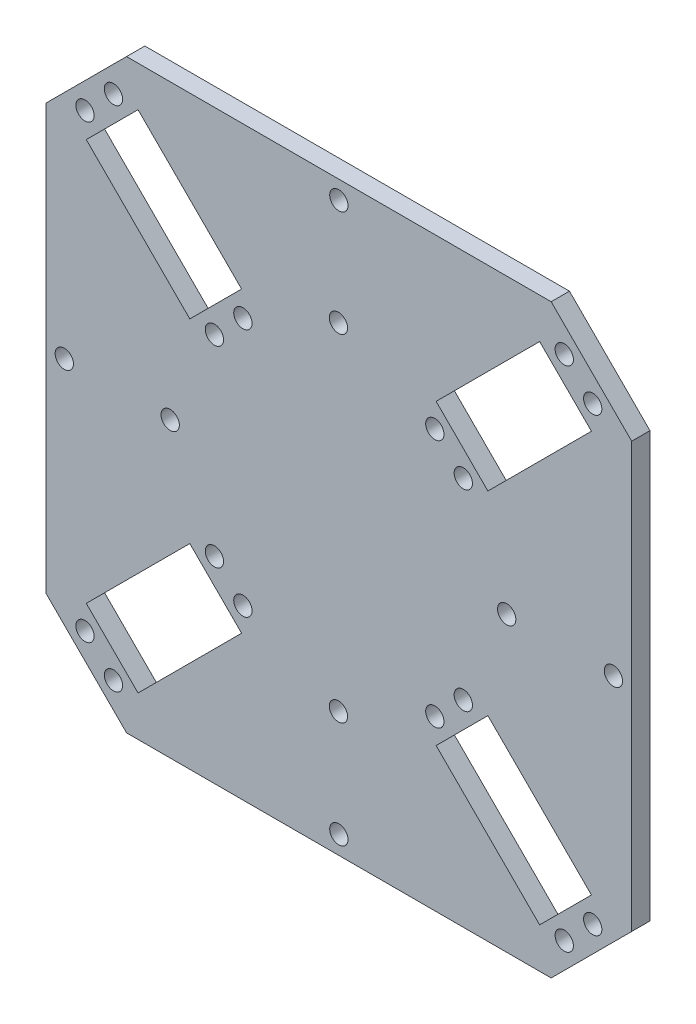
from build123d import *

# Parameters (mm, degrees)
ESQUISSE1_W               = 160
ESQUISSE1_H               = 160
BOSS_EXTRU_1_DEPTH        = 5
CHANFREIN3_SIZE           = 22
CHANFREIN4_SIZE           = 22
ENL_V_MAT_EXTRU_1_DEPTH   = 5
SYM_TRIE2_COPY_1_DEPTH    = 5
ESQUISSE8_R               = 2.5
ENL_V_MAT_EXTRU_2_DEPTH   = 5
SYM_TRIE4_COPY_1_SKETCH_R = 2.5
SYM_TRIE4_COPY_1_DEPTH    = 5
ESQUISSE9_R               = 2.5
ENL_V_MAT_EXTRU_3_DEPTH   = 5
SYM_TRIE6_COPY_1_SKETCH_R = 2.5
SYM_TRIE6_COPY_1_DEPTH    = 5
ESQUISSE10_R              = 2.5
ENL_V_MAT_EXTRU_4_DEPTH   = 10
ESQUISSE12_R              = 2.5
ENL_V_MAT_EXTRU_5_DEPTH   = 10


with BuildPart() as part:
    # Esquisse1 → Boss.-Extru.1 (new body)
    with BuildSketch(Plane.XY):
        with Locations((80, -80)):
            Rectangle(ESQUISSE1_W, ESQUISSE1_H)
    extrude(amount=BOSS_EXTRU_1_DEPTH)

    # Chanfrein3
    chanfrein3_edges = [part.edges().sort_by_distance(p)[0] for p in [
        (0, 0, 2.5),
    ]]
    chamfer(chanfrein3_edges, length=CHANFREIN3_SIZE)

    # Chanfrein4
    chanfrein4_edges = [part.edges().sort_by_distance(p)[0] for p in [
        (160, 0, 2.5),
        (160, -160, 2.5),
        (0, -160, 2.5),
    ]]
    chamfer(chanfrein4_edges, length=CHANFREIN4_SIZE)

    # Esquisse3 → Enlèv. mat.-Extru.1 (cut)
    with BuildSketch(Plane.XY.offset(5)):
        Polygon((25.143089642, -10.999045981), (11.000954019, -25.141181605), (39.285225266, -53.425452853), (53.42736089, -39.283317229), align=None)
    enl_v_mat_extru_1 = extrude(amount=-ENL_V_MAT_EXTRU_1_DEPTH, mode=Mode.SUBTRACT)

    # Symétrie1: Enlèv. mat.-Extru.1 across plane
    add(enl_v_mat_extru_1.mirror(Plane.ZX.offset(-80)), mode=Mode.SUBTRACT)

    # Symétrie2: Enlèv. mat.-Extru.1 across plane
    add(enl_v_mat_extru_1.mirror(Plane(origin=(80, 0, 0), x_dir=(0, 0, 1), z_dir=(1, 0, 0))), mode=Mode.SUBTRACT)

    # Symétrie2 copy 1 sketch → Symétrie2 copy 1 (cut)
    with BuildSketch(Plane(origin=(160, -160, 5), x_dir=(-1, 0, 0), z_dir=(0, 0, 1))):
        Polygon((25.143089642, -10.999045981), (11.000954019, -25.141181605), (39.285225266, -53.425452853), (53.42736089, -39.283317229), align=None)
    extrude(amount=-SYM_TRIE2_COPY_1_DEPTH, mode=Mode.SUBTRACT)

    # Esquisse8 → Enlèv. mat.-Extru.2 (cut)
    with BuildSketch(Plane.XY.offset(5)):
        with Locations((10.647400628, -18.423667184)):
            Circle(ESQUISSE8_R)
        with Locations((18.425575221, -10.645492591)):
            Circle(ESQUISSE8_R)
    enl_v_mat_extru_2 = extrude(amount=-ENL_V_MAT_EXTRU_2_DEPTH, mode=Mode.SUBTRACT)

    # Symétrie3: Enlèv. mat.-Extru.2 across plane
    add(enl_v_mat_extru_2.mirror(Plane.ZX.offset(-80)), mode=Mode.SUBTRACT)

    # Symétrie4: Enlèv. mat.-Extru.2 across plane
    add(enl_v_mat_extru_2.mirror(Plane(origin=(80, 0, 0), x_dir=(0, 0, 1), z_dir=(1, 0, 0))), mode=Mode.SUBTRACT)

    # Symétrie4 copy 1 sketch → Symétrie4 copy 1 (cut)
    with BuildSketch(Plane(origin=(160, -160, 5), x_dir=(-1, 0, 0), z_dir=(0, 0, 1))):
        with Locations((10.647400628, -18.423667184)):
            Circle(SYM_TRIE4_COPY_1_SKETCH_R)
        with Locations((18.425575221, -10.645492591)):
            Circle(SYM_TRIE4_COPY_1_SKETCH_R)
    extrude(amount=-SYM_TRIE4_COPY_1_DEPTH, mode=Mode.SUBTRACT)

    # Esquisse9 → Enlèv. mat.-Extru.3 (cut)
    with BuildSketch(Plane.XY.offset(5)):
        with Locations((53.78091428, -46.00083165)):
            Circle(ESQUISSE9_R)
        with Locations((46.002739687, -53.779006243)):
            Circle(ESQUISSE9_R)
    enl_v_mat_extru_3 = extrude(amount=-ENL_V_MAT_EXTRU_3_DEPTH, mode=Mode.SUBTRACT)

    # Symétrie5: Enlèv. mat.-Extru.3 across plane
    add(enl_v_mat_extru_3.mirror(Plane.ZX.offset(-80)), mode=Mode.SUBTRACT)

    # Symétrie6: Enlèv. mat.-Extru.3 across plane
    add(enl_v_mat_extru_3.mirror(Plane(origin=(80, 0, 0), x_dir=(0, 0, 1), z_dir=(1, 0, 0))), mode=Mode.SUBTRACT)

    # Symétrie6 copy 1 sketch → Symétrie6 copy 1 (cut)
    with BuildSketch(Plane(origin=(160, -160, 5), x_dir=(-1, 0, 0), z_dir=(0, 0, 1))):
        with Locations((53.78091428, -46.00083165)):
            Circle(SYM_TRIE6_COPY_1_SKETCH_R)
        with Locations((46.002739687, -53.779006243)):
            Circle(SYM_TRIE6_COPY_1_SKETCH_R)
    extrude(amount=-SYM_TRIE6_COPY_1_DEPTH, mode=Mode.SUBTRACT)

    # Esquisse10 → Enlèv. mat.-Extru.4 (cut)
    with BuildSketch(Plane.XY.offset(5)):
        with Locations((79.885822331, -34.038059223)):
            Circle(ESQUISSE10_R)
        with Locations((33.923881554, -80)):
            Circle(ESQUISSE10_R)
        with Locations((79.885822331, -125.961940777)):
            Circle(ESQUISSE10_R)
        with Locations((125.847763109, -80)):
            Circle(ESQUISSE10_R)
    extrude(amount=-ENL_V_MAT_EXTRU_4_DEPTH, mode=Mode.SUBTRACT)

    # Esquisse12 → Enlèv. mat.-Extru.5 (cut)
    with BuildSketch(Plane.XY.offset(5)):
        with Locations((5, -80)):
            Circle(ESQUISSE12_R)
        with Locations((155, -80)):
            Circle(ESQUISSE12_R)
        with Locations((80, -155)):
            Circle(ESQUISSE12_R)
        with Locations((80, -5)):
            Circle(ESQUISSE12_R)
    extrude(amount=-ENL_V_MAT_EXTRU_5_DEPTH, mode=Mode.SUBTRACT)


solid = part.part
